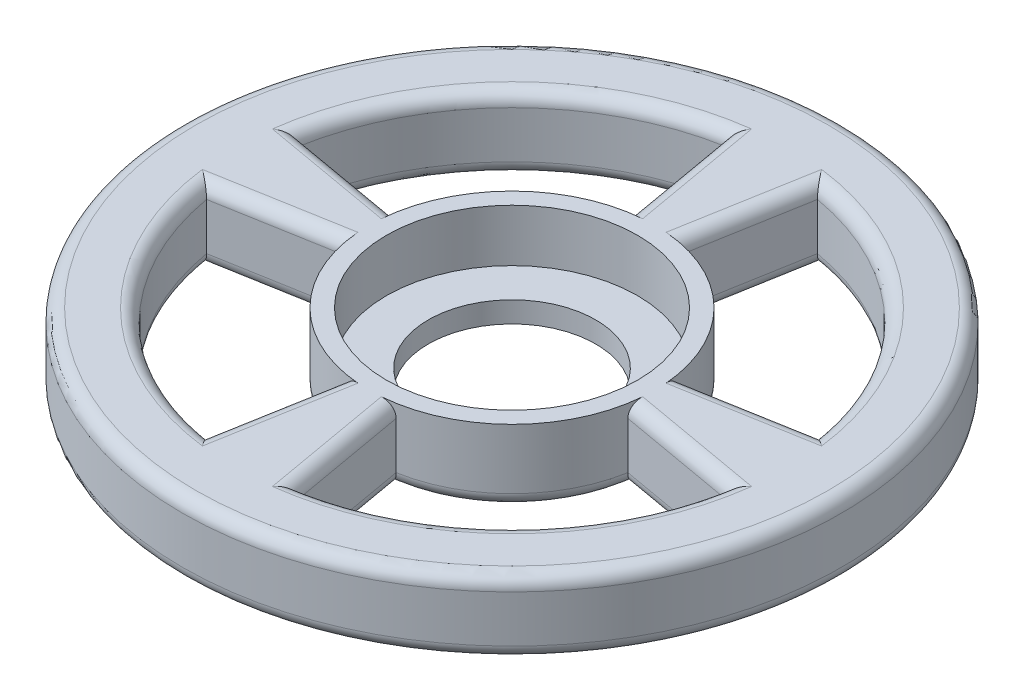
from build123d import *

# Parameters (mm, degrees)
SKETCH1_R           = 25
SKETCH1_R_2         = 6.35
BOSS_EXTRUDE1_DEPTH = 5.55625
SKETCH2_R           = 9.525
CUT_EXTRUDE1_DEPTH  = 3.96875
CUT_EXTRUDE2_DEPTH  = 36.789270935
FILLET2_R           = 1


with BuildPart() as part:
    # Sketch1 → Boss-Extrude1 (new body)
    with BuildSketch(Plane(origin=(0, 0, 0), x_dir=(1, 0, 0), z_dir=(0, 1, 0))):
        with Locations(Location((0, 0, 0), (0, 0, 270))):
            Circle(SKETCH1_R)
        with Locations(Location((0, 0, 0), (0, 0, 270))):
            Circle(SKETCH1_R_2, mode=Mode.SUBTRACT)
    extrude(amount=BOSS_EXTRUDE1_DEPTH)

    # Sketch2 → Cut-Extrude1 (cut)
    with BuildSketch(Plane(origin=(0, 5.55625, 0), x_dir=(1, 0, 0), z_dir=(0, 1, 0))):
        with Locations(Location((0, 0, 0), (0, 0, 270))):
            Circle(SKETCH2_R)
    extrude(amount=-CUT_EXTRUDE1_DEPTH, mode=Mode.SUBTRACT)

    # Sketch3 → Cut-Extrude2 (cut, through all)
    with BuildSketch(Plane(origin=(0, 5.55625, 0), x_dir=(1, 0, 0), z_dir=(0, 1, 0))):
        with BuildLine():
            Line((-1.882183896, 10.674395311), (-3.472963553, 19.69615506))
            ThreePointArc((-3.472963553, 19.69615506), (-14.142135624, 14.142135624), (-19.69615506, 3.472963553))
            Line((-19.69615506, 3.472963553), (-10.674395311, 1.882183896))
            ThreePointArc((-10.674395311, 1.882183896), (-7.664376409, 7.664376409), (-1.882183896, 10.674395311))
        make_face()
        with BuildLine():
            Line((1.882183896, 10.674395311), (3.472963553, 19.69615506))
            ThreePointArc((3.472963553, 19.69615506), (14.142135624, 14.142135624), (19.69615506, 3.472963553))
            Line((19.69615506, 3.472963553), (10.674395311, 1.882183896))
            ThreePointArc((10.674395311, 1.882183896), (7.664376409, 7.664376409), (1.882183896, 10.674395311))
        make_face()
        with BuildLine():
            Line((10.674395311, -1.882183896), (19.69615506, -3.472963553))
            ThreePointArc((19.69615506, -3.472963553), (14.142135624, -14.142135624), (3.472963553, -19.69615506))
            Line((3.472963553, -19.69615506), (1.882183896, -10.674395311))
            ThreePointArc((1.882183896, -10.674395311), (7.664376409, -7.664376409), (10.674395311, -1.882183896))
        make_face()
        with BuildLine():
            Line((-1.882183896, -10.674395311), (-3.472963553, -19.69615506))
            ThreePointArc((-3.472963553, -19.69615506), (-14.142135624, -14.142135624), (-19.69615506, -3.472963553))
            Line((-19.69615506, -3.472963553), (-10.674395311, -1.882183896))
            ThreePointArc((-10.674395311, -1.882183896), (-7.664376409, -7.664376409), (-1.882183896, -10.674395311))
        make_face()
    extrude(amount=-CUT_EXTRUDE2_DEPTH, mode=Mode.SUBTRACT)

    # Fillet2
    fillet2_edges = [part.edges().sort_by_distance(p)[0] for p in [
        (0, 0, -25),
        (14.142135624, 0, 14.142135624),
        (2.677573725, 0, 15.185275186),
        (7.664376409, 0, 7.664376409),
        (15.185275186, 0, 2.677573725),
        (14.142135624, 5.55625, 14.142135624),
        (15.185275186, 5.55625, 2.677573725),
        (2.677573725, 5.55625, 15.185275186),
        (14.142135624, 0, -14.142135624),
        (15.185275186, 0, -2.677573725),
        (7.664376409, 0, -7.664376409),
        (2.677573725, 0, -15.185275186),
        (14.142135624, 5.55625, -14.142135624),
        (2.677573725, 5.55625, -15.185275186),
        (15.185275186, 5.55625, -2.677573725),
        (0, 5.55625, -25),
        (-7.664376409, 0, -7.664376409),
        (-15.185275186, 0, -2.677573725),
        (-14.142135624, 0, -14.142135624),
        (-2.677573725, 0, -15.185275186),
        (-2.677573725, 5.55625, -15.185275186),
        (-14.142135624, 5.55625, -14.142135624),
        (-15.185275186, 5.55625, -2.677573725),
        (-14.142135624, 0, 14.142135624),
        (-15.185275186, 0, 2.677573725),
        (-7.664376409, 0, 7.664376409),
        (-2.677573725, 0, 15.185275186),
        (-14.142135624, 5.55625, 14.142135624),
        (-2.677573725, 5.55625, 15.185275186),
        (-15.185275186, 5.55625, 2.677573725),
    ]]
    fillet(fillet2_edges, radius=FILLET2_R)


solid = part.part
